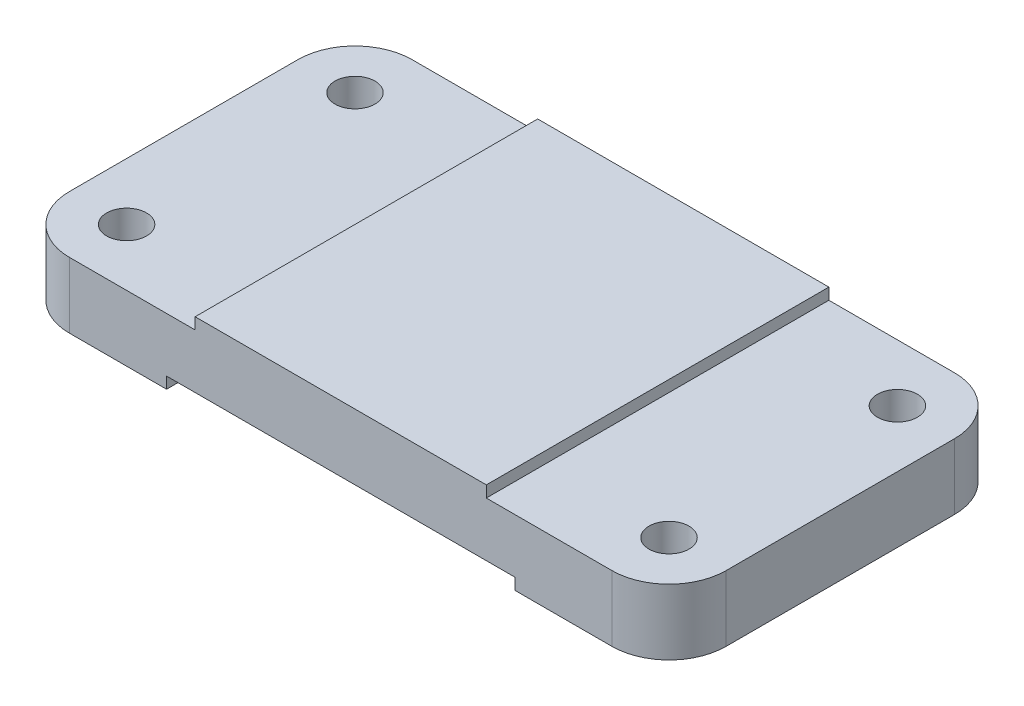
from build123d import *

# Parameters (mm, degrees)
BOSS_EXTRUDE1_DEPTH = 23
SKETCH3_W           = 102
SKETCH3_H           = 120
BOSS_EXTRUDE2_DEPTH = 4
SKETCH4_W           = 122
SKETCH4_H           = 120
CUT_EXTRUDE1_DEPTH  = 4
M16_TAPPED_HOLE1_D  = 14


with BuildPart() as part:
    # Sketch1 → Boss-Extrude1 (new body)
    with BuildSketch(Plane(origin=(0, 0, 0), x_dir=(1, 0, 0), z_dir=(0, 1, 0))):
        with BuildLine():
            Line((-95, 60), (95, 60))
            ThreePointArc((95, 60), (109.142135624, 54.142135624), (115, 40))
            Line((115, 40), (115, -40))
            ThreePointArc((115, -40), (109.142135624, -54.142135624), (95, -60))
            Line((95, -60), (-95, -60))
            ThreePointArc((-95, -60), (-109.142135624, -54.142135624), (-115, -40))
            Line((-115, -40), (-115, 40))
            ThreePointArc((-115, 40), (-109.142135624, 54.142135624), (-95, 60))
        make_face()
    extrude(amount=BOSS_EXTRUDE1_DEPTH)

    # Sketch3 → Boss-Extrude2 (add)
    with BuildSketch(Plane(origin=(0, 23, 0), x_dir=(1, 0, 0), z_dir=(0, 1, 0))):
        Rectangle(SKETCH3_W, SKETCH3_H)
    extrude(amount=BOSS_EXTRUDE2_DEPTH)

    # Sketch4 → Cut-Extrude1 (cut)
    with BuildSketch(Plane.XZ):
        Rectangle(SKETCH4_W, SKETCH4_H)
    extrude(amount=-CUT_EXTRUDE1_DEPTH, mode=Mode.SUBTRACT)

    # M16 Tapped Hole1 (through all)
    with Locations(Plane(origin=(-95, 23, -40), x_dir=(0, 0, 1), z_dir=(0, 1, 0))):
        with Locations((0, 0), (80, 0), (0, 190), (80, 190)):
            Hole(M16_TAPPED_HOLE1_D / 2)


solid = part.part
